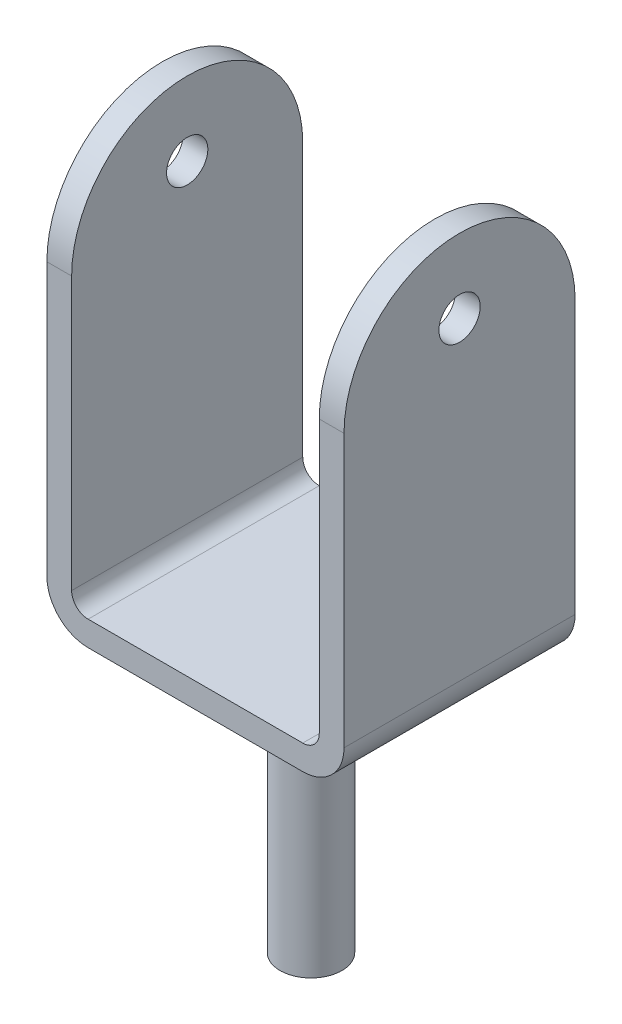
from build123d import *

# Parameters (mm, degrees)
BOSS_EXTRUDE1_DEPTH = 140
SKETCH1_4_W         = 37.5
SKETCH1_4_H         = 325
SKETCH2_R           = 25
CUT_EXTRUDE1_DEPTH  = 930.099025939
FILLET3_RADIUS      = 140
FILLET3_LENGTH      = 30
FILLET4_RADIUS      = 140
FILLET4_LENGTH      = 30


with BuildPart() as part:
    # Sketch1 → Boss-Extrude1 (new, symmetric)
    with BuildSketch(Plane.XY):
        with BuildLine():
            Line((112.5, 375), (112.5, 845))
            Line((112.5, 845), (142.5, 845))
            Line((142.5, 845), (142.5, 375))
            ThreePointArc((142.5, 375), (127.855339059, 339.644660941), (92.5, 325))
            Line((92.5, 325), (-167.5, 325))
            ThreePointArc((-167.5, 325), (-202.855339059, 339.644660941), (-217.5, 375))
            Line((-217.5, 375), (-217.5, 845))
            Line((-217.5, 845), (-187.5, 845))
            Line((-187.5, 845), (-187.5, 375))
            ThreePointArc((-187.5, 375), (-181.642135624, 360.857864376), (-167.5, 355))
            Line((-167.5, 355), (92.5, 355))
            ThreePointArc((92.5, 355), (106.642135624, 360.857864376), (112.5, 375))
        make_face()
    extrude(amount=BOSS_EXTRUDE1_DEPTH, both=True)

    # Sketch1<4> → Revolve1 (revolve)
    with BuildSketch(Plane.XY, mode=Mode.PRIVATE) as revolve1_sk:
        with Locations((-18.75, 162.5)):
            Rectangle(SKETCH1_4_W, SKETCH1_4_H)
    revolve(revolve1_sk.sketch.rotate(Axis((-37.5, 325, 0), (0, -1, 0)), 180), axis=Axis((-37.5, 325, 0), (0, -1, 0)))

    # Sketch2 → Cut-Extrude1 (cut, through all)
    with BuildSketch(Plane(origin=(142.5, 0, 0), x_dir=(0, 0, -1), z_dir=(1, 0, 0))):
        with Locations(Location((0, 755.572053684, 0), (0, 0, 90))):
            Circle(SKETCH2_R)
    extrude(amount=-CUT_EXTRUDE1_DEPTH, mode=Mode.SUBTRACT)

    # Fillet3: full round fillet: the end face becomes a half cylinder, R = half its width
    fillet3_face = Plane((127.5, 845, 0), x_dir=(-1, 0, 0), z_dir=(0, 1, 0))  # on the end face: x along it, z out of the body
    fillet3_slab = fillet3_face.offset(-FILLET3_RADIUS / 2) * Box(FILLET3_LENGTH, 2 * FILLET3_RADIUS, FILLET3_RADIUS, mode=Mode.PRIVATE)  # the body's end, R deep
    fillet3_round = Plane((127.5, 705, 0), x_dir=(0, 1, 0), z_dir=(-1, 0, 0)) * Cylinder(FILLET3_RADIUS, FILLET3_LENGTH, mode=Mode.PRIVATE)  # its axis R under the face
    add(fillet3_slab - fillet3_round, mode=Mode.SUBTRACT)

    # Fillet4: full round fillet: the end face becomes a half cylinder, R = half its width
    fillet4_face = Plane((-202.5, 845, 0), x_dir=(-1, 0, 0), z_dir=(0, 1, 0))  # on the end face: x along it, z out of the body
    fillet4_slab = fillet4_face.offset(-FILLET4_RADIUS / 2) * Box(FILLET4_LENGTH, 2 * FILLET4_RADIUS, FILLET4_RADIUS, mode=Mode.PRIVATE)  # the body's end, R deep
    fillet4_round = Plane((-202.5, 705, 0), x_dir=(0, 1, 0), z_dir=(-1, 0, 0)) * Cylinder(FILLET4_RADIUS, FILLET4_LENGTH, mode=Mode.PRIVATE)  # its axis R under the face
    add(fillet4_slab - fillet4_round, mode=Mode.SUBTRACT)


solid = part.part
